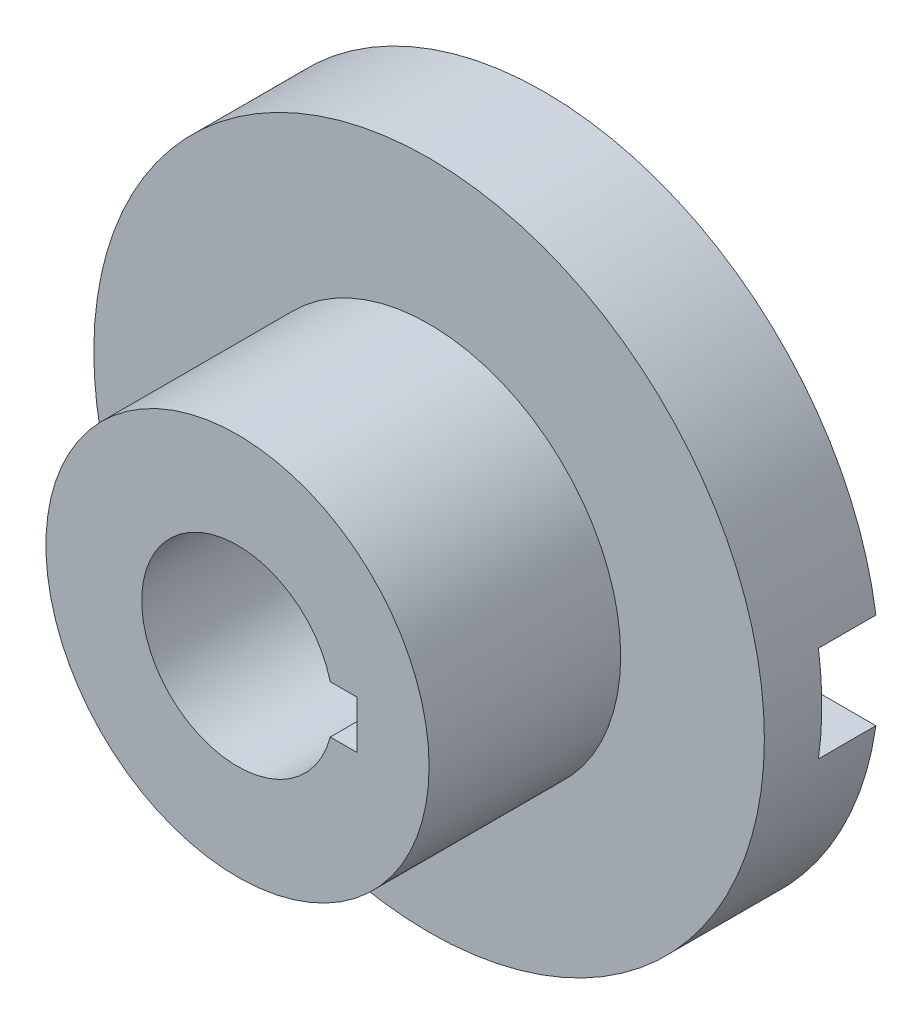
from build123d import *

# Parameters (mm, degrees)
SKETCH1_R           = 35
BOSS_EXTRUDE1_DEPTH = 6
SKETCH2_R           = 20
SKETCH2_R_2         = 10
BOSS_EXTRUDE2_DEPTH = 20
CUT_EXTRUDE1_START  = -20
SKETCH3_R           = 10
CUT_EXTRUDE1_DEPTH  = 20
SKETCH4_W           = 5
SKETCH4_H           = 5
CUT_EXTRUDE2_DEPTH  = 59.940648113
SKETCH5_W           = 82.032874524
SKETCH5_H           = 10
CUT_EXTRUDE3_DEPTH  = 6


with BuildPart() as part:
    # Sketch1 → Boss-Extrude1 (new, symmetric)
    with BuildSketch(Plane.XY):
        Circle(SKETCH1_R)
    extrude(amount=BOSS_EXTRUDE1_DEPTH, both=True)

    # Sketch2 → Boss-Extrude2 (add)
    with BuildSketch(Plane.XY.offset(6)):
        Circle(SKETCH2_R)
        Circle(SKETCH2_R_2, mode=Mode.SUBTRACT)
    extrude(amount=BOSS_EXTRUDE2_DEPTH)

    # Sketch3 → Cut-Extrude1 (cut)
    with BuildSketch(Plane.XY.offset(6).offset(CUT_EXTRUDE1_START)):
        Circle(SKETCH3_R)
    extrude(amount=CUT_EXTRUDE1_DEPTH, mode=Mode.SUBTRACT)

    # Sketch4 → Cut-Extrude2 (cut, through all)
    with BuildSketch(Plane.XY.offset(26)):
        with Locations((10, 0)):
            Rectangle(SKETCH4_W, SKETCH4_H)
    extrude(amount=-CUT_EXTRUDE2_DEPTH, mode=Mode.SUBTRACT)

    # Sketch5 → Cut-Extrude3 (cut)
    with BuildSketch(Plane(origin=(0, 0, -6), x_dir=(-1, 0, 0), z_dir=(0, 0, -1))):
        Rectangle(SKETCH5_W, SKETCH5_H)
    extrude(amount=-CUT_EXTRUDE3_DEPTH, mode=Mode.SUBTRACT)


solid = part.part
